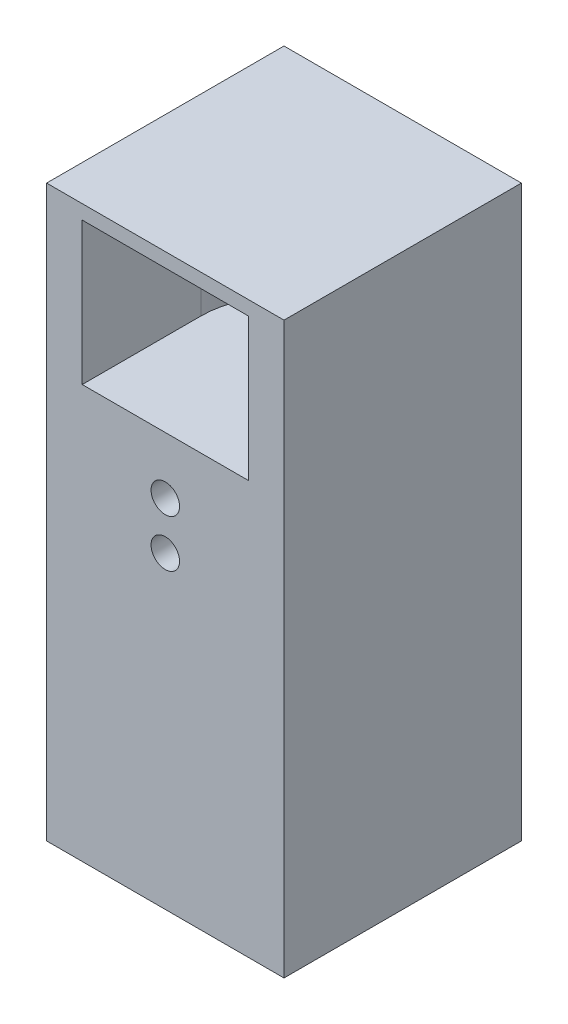
from build123d import *

# Parameters (mm, degrees)
SKETCH5_W           = 127
SKETCH5_H           = 127
BOSS_EXTRUDE1_DEPTH = 304.8
SKETCH6_R           = 44.45
CUT_EXTRUDE1_DEPTH  = 203.2
SKETCH5_3_W         = 20.32
SKETCH5_3_H         = 20.32
CUT_EXTRUDE2_DEPTH  = 25.4
CUT_EXTRUDE3_START  = -76.2
CUT_EXTRUDE3_DEPTH  = 76.2
SKETCH9_R           = 7.62
CUT_EXTRUDE4_DEPTH  = 56.642


with BuildPart() as part:
    # Sketch5 → Boss-Extrude1 (new body)
    with BuildSketch(Plane(origin=(0, 0, 0), x_dir=(1, 0, 0), z_dir=(0, 1, 0))):
        with Locations((63.5, 63.5)):
            Rectangle(SKETCH5_W, SKETCH5_H)
    extrude(amount=BOSS_EXTRUDE1_DEPTH)

    # Sketch6 → Cut-Extrude1 (cut)
    with BuildSketch(Plane(origin=(0, 0, 0), x_dir=(1, 0, 0), z_dir=(0, 1, 0))):
        with Locations((63.5, 63.5)):
            Circle(SKETCH6_R)
    extrude(amount=CUT_EXTRUDE1_DEPTH, mode=Mode.SUBTRACT)

    # Sketch5<3> → Cut-Extrude2 (cut)
    with BuildSketch(Plane(origin=(0, 0, 0), x_dir=(1, 0, 0), z_dir=(0, 1, 0))):
        with Locations((110.49, 15.457317153)):
            Rectangle(SKETCH5_3_W, SKETCH5_3_H)
        with Locations((16.51, 15.457317153)):
            Rectangle(SKETCH5_3_W, SKETCH5_3_H)
        with Locations((110.49, 110.49)):
            Rectangle(SKETCH5_3_W, SKETCH5_3_H)
        with Locations((16.51, 110.49)):
            Rectangle(SKETCH5_3_W, SKETCH5_3_H)
    extrude(amount=CUT_EXTRUDE2_DEPTH, mode=Mode.SUBTRACT)

    # Sketch7 → Cut-Extrude3 (cut)
    with BuildSketch(Plane(origin=(0, 297.18, 0), x_dir=(1, 0, 0), z_dir=(0, 1, 0)).offset(CUT_EXTRUDE3_START)):
        with BuildLine():
            Line((107.95, 63.5), (107.95, -124.596764807))
            Line((107.95, -124.596764807), (19.05, -124.596764807))
            Line((19.05, -124.596764807), (19.05, 63.5))
            ThreePointArc((19.05, 63.5), (63.5, 107.95), (107.95, 63.5))
        make_face()
    extrude(amount=CUT_EXTRUDE3_DEPTH, mode=Mode.SUBTRACT)

    # Sketch9 → Cut-Extrude4 (cut)
    with BuildSketch(Plane.XY):
        with Locations((63.5, 190.5)):
            Circle(SKETCH9_R)
        with Locations((63.5, 165.1)):
            Circle(SKETCH9_R)
    extrude(amount=-CUT_EXTRUDE4_DEPTH, mode=Mode.SUBTRACT)


solid = part.part
